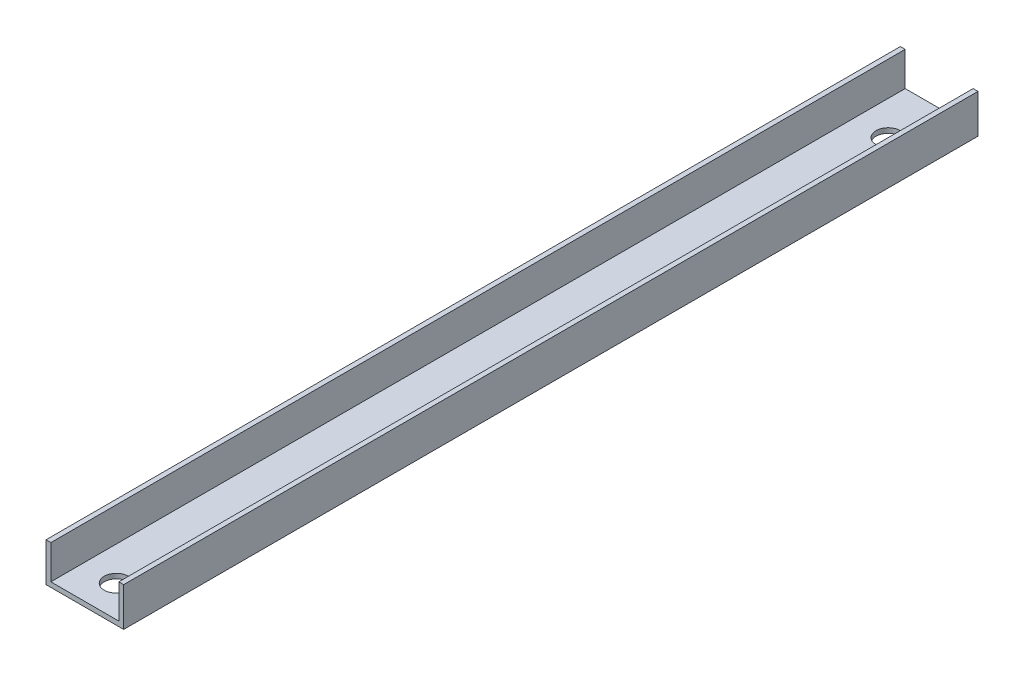
from build123d import *

# Parameters (mm, degrees)
BOSS_EXTRUDE1_DEPTH = 558.8
CUT_EXTRUDE1_REACH  = 561.953
SKETCH2_R           = 7.9375
CUT_EXTRUDE2_REACH  = 561.953
SKETCH3_R           = 7.9375


with BuildPart() as part:
    # Sketch1 → Boss-Extrude1 (new body)
    with BuildSketch(Plane.XY):
        Polygon((-22.225, -9.525), (-22.225, 12.7), (-25.4, 12.7), (-25.4, -12.7), (25.4, -12.7), (25.4, 12.7), (22.225, 12.7), (22.225, -9.525), align=None)
    extrude(amount=BOSS_EXTRUDE1_DEPTH)

    # Sketch2 → Cut-Extrude1 (cut, up to next)
    with BuildSketch(Plane.XZ.offset(12.7), mode=Mode.PRIVATE) as cut_extrude1_sk1:
        with Locations((0, 33.3375)):
            Circle(SKETCH2_R)
    cut_extrude1_tool1 = extrude(cut_extrude1_sk1.sketch, amount=-CUT_EXTRUDE1_REACH, mode=Mode.PRIVATE) & part.part
    add(cut_extrude1_tool1.solids().sort_by_distance((0, -12.7, 33.3375))[0], mode=Mode.SUBTRACT)

    # Sketch3 → Cut-Extrude2 (cut, up to next)
    with BuildSketch(Plane.XZ.offset(12.7), mode=Mode.PRIVATE) as cut_extrude2_sk1:
        with Locations((0, 538.1625)):
            Circle(SKETCH3_R)
    cut_extrude2_tool1 = extrude(cut_extrude2_sk1.sketch, amount=-CUT_EXTRUDE2_REACH, mode=Mode.PRIVATE) & part.part
    add(cut_extrude2_tool1.solids().sort_by_distance((0, -12.7, 538.1625))[0], mode=Mode.SUBTRACT)


solid = part.part
